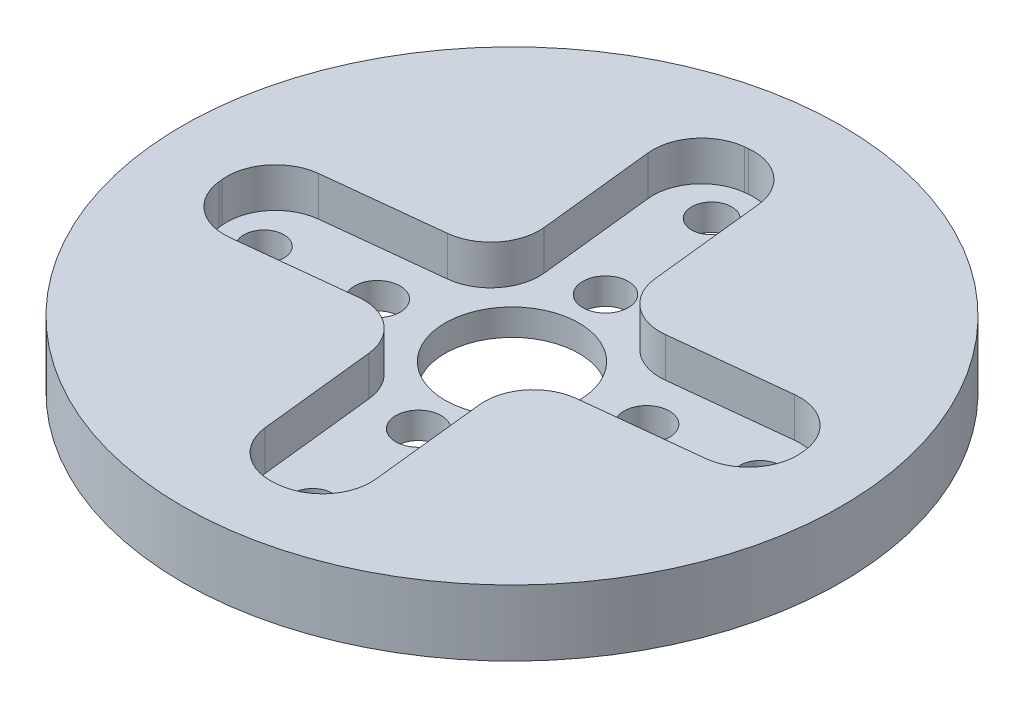
from build123d import *

# Parameters (mm, degrees)
SKETCH_1_R      = 25
EXTRUDE_1_DEPTH = 5
SKETCH_3_R      = 22.5
SKETCH_3_R_2    = 1.524
SKETCH_3_R_3    = 1.7272
SKETCH_3_R_4    = 5.08
EXTRUDE_2_DEPTH = 2


with BuildPart() as part:
    # 草圖1 → 填料-伸長1 (new body)
    with BuildSketch(Plane(origin=(0, 0, 0), x_dir=(1, 0, 0), z_dir=(0, 1, 0))):
        with Locations(Location((0, 0, 0), (0, 0, 270))):
            Circle(SKETCH_1_R)
        with BuildLine():
            Line((-19.962936653, -2.035103236), (-19.935577611, -2.287625478))
            ThreePointArc((-19.935577611, -2.287625478), (-18.582614267, -4.760555699), (-15.877298983, -5.552491873))
            Line((-15.877298983, -5.552491873), (-7.039020507, -4.594925386))
            ThreePointArc((-7.039020507, -4.594925386), (-4.333705223, -5.38686156), (-2.980741879, -7.859791782))
            Line((-2.980741879, -7.859791782), (-2.023175392, -16.698070258))
            ThreePointArc((-2.023175392, -16.698070258), (-0.670212048, -19.171000479), (2.035103236, -19.962936653))
            Line((2.035103236, -19.962936653), (2.287625478, -19.935577611))
            ThreePointArc((2.287625478, -19.935577611), (4.760555699, -18.582614267), (5.552491873, -15.877298983))
            Line((5.552491873, -15.877298983), (4.594925386, -7.039020507))
            ThreePointArc((4.594925386, -7.039020507), (5.38686156, -4.333705223), (7.859791782, -2.980741879))
            Line((7.859791782, -2.980741879), (16.698070258, -2.023175392))
            ThreePointArc((16.698070258, -2.023175392), (19.171000479, -0.670212048), (19.962936653, 2.035103236))
            Line((19.962936653, 2.035103236), (19.935577611, 2.287625478))
            ThreePointArc((19.935577611, 2.287625478), (18.582614267, 4.760555699), (15.877298983, 5.552491873))
            Line((15.877298983, 5.552491873), (7.039020507, 4.594925386))
            ThreePointArc((7.039020507, 4.594925386), (4.333705223, 5.38686156), (2.980741879, 7.859791782))
            Line((2.980741879, 7.859791782), (2.023175392, 16.698070258))
            ThreePointArc((2.023175392, 16.698070258), (0.670212048, 19.171000479), (-2.035103236, 19.962936653))
            Line((-2.035103236, 19.962936653), (-2.287625478, 19.935577611))
            ThreePointArc((-2.287625478, 19.935577611), (-4.760555699, 18.582614267), (-5.552491873, 15.877298983))
            Line((-5.552491873, 15.877298983), (-4.594925386, 7.039020507))
            ThreePointArc((-4.594925386, 7.039020507), (-5.38686156, 4.333705223), (-7.859791782, 2.980741879))
            Line((-7.859791782, 2.980741879), (-16.698070258, 2.023175392))
            ThreePointArc((-16.698070258, 2.023175392), (-19.171000479, 0.670212048), (-19.962936653, -2.035103236))
        make_face(mode=Mode.SUBTRACT)
    extrude(amount=EXTRUDE_1_DEPTH)

    # 草圖3 → 填料-伸長2 (add)
    with BuildSketch(Plane(origin=(0, 0, 0), x_dir=(1, 0, 0), z_dir=(0, 1, 0))):
        Circle(SKETCH_3_R)
        with Locations(Location((16.982120786, 1.839895607, 0), (0, 0, 270))):
            Circle(SKETCH_3_R_2, mode=Mode.SUBTRACT)
        with Locations(Location((9.217061839, 0.998605051, 0), (0, 0, 270))):
            Circle(SKETCH_3_R_3, mode=Mode.SUBTRACT)
        with Locations(Location((1.839895607, -16.982120786, 0), (0, 0, 270))):
            Circle(SKETCH_3_R_2, mode=Mode.SUBTRACT)
        with Locations(Location((0.861809838, -7.954450629, 0), (0, 0, 270))):
            Circle(SKETCH_3_R_3, mode=Mode.SUBTRACT)
        with Locations(Location((0, 0, 0), (0, 0, 270))):
            Circle(SKETCH_3_R_4, mode=Mode.SUBTRACT)
        with Locations(Location((-16.982120786, -1.839895607, 0), (0, 0, 270))):
            Circle(SKETCH_3_R_2, mode=Mode.SUBTRACT)
        with Locations(Location((-9.217061839, -0.998605051, 0), (0, 0, 270))):
            Circle(SKETCH_3_R_3, mode=Mode.SUBTRACT)
        with Locations(Location((-1.839895607, 16.982120786, 0), (0, 0, 270))):
            Circle(SKETCH_3_R_2, mode=Mode.SUBTRACT)
        with Locations(Location((-0.861809838, 7.954450629, 0), (0, 0, 270))):
            Circle(SKETCH_3_R_3, mode=Mode.SUBTRACT)
    extrude(amount=EXTRUDE_2_DEPTH)


solid = part.part
